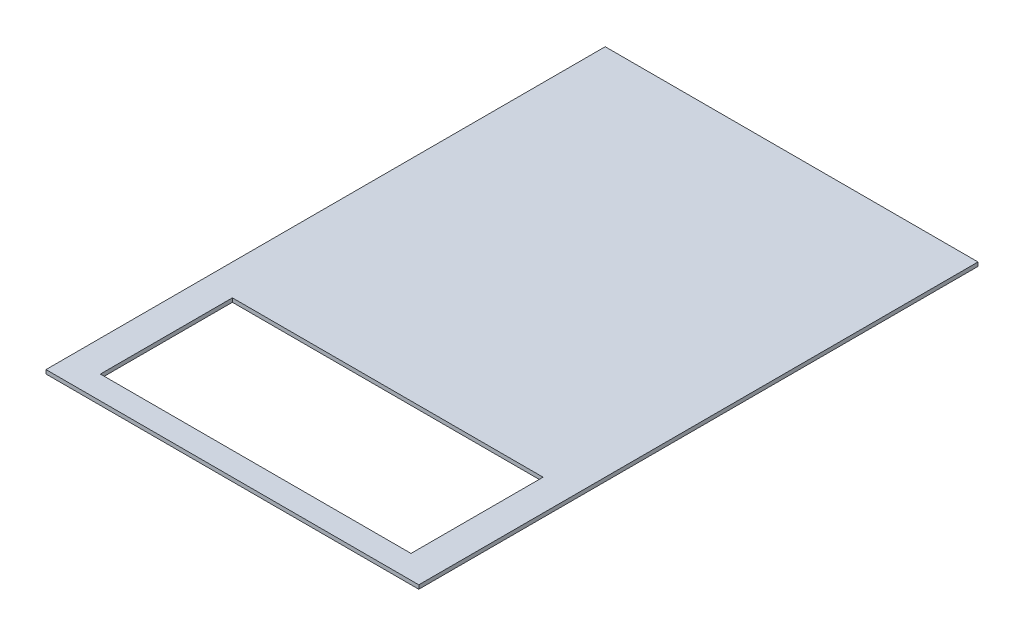
from build123d import *

# Parameters (mm, degrees)
SKETCH1_W           = 609.6
SKETCH1_H           = 914.4
BOSS_EXTRUDE1_DEPTH = 6.35
SKETCH2_W           = 508
SKETCH2_H           = 215.9
CUT_EXTRUDE1_DEPTH  = 550.522704263


with BuildPart() as part:
    # Sketch1 → Boss-Extrude1 (new body)
    with BuildSketch(Plane(origin=(0, 0, 0), x_dir=(1, 0, 0), z_dir=(0, 1, 0))):
        Rectangle(SKETCH1_W, SKETCH1_H)
    extrude(amount=BOSS_EXTRUDE1_DEPTH)

    # Sketch2 → Cut-Extrude1 (cut, through all)
    with BuildSketch(Plane(origin=(0, 6.35, 0), x_dir=(1, 0, 0), z_dir=(0, 1, 0))):
        with Locations((0, -311.15)):
            Rectangle(SKETCH2_W, SKETCH2_H)
    extrude(amount=-CUT_EXTRUDE1_DEPTH, mode=Mode.SUBTRACT)


solid = part.part
